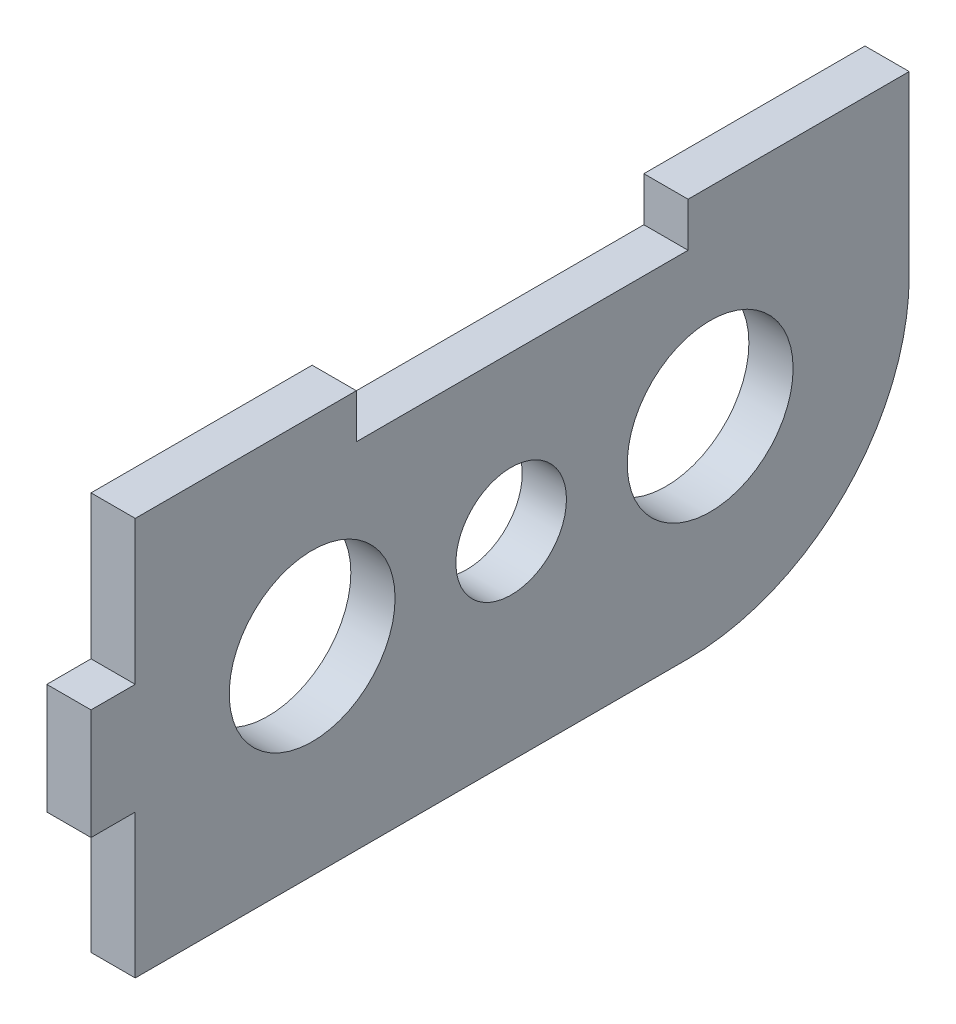
from build123d import *

# Parameters (mm, degrees)
AUFSATZ_LINEAR_AUSTRAGEN1_DEPTH = 4
SKIZZE3_W                       = 30
SKIZZE3_H                       = 4
SCHNITT_LINEAR_AUSTRAGEN2_DEPTH = 77.26270386
VERRUNDUNG1_R                   = 20
SKIZZE5_R                       = 7.5
SKIZZE5_R_2                     = 5
SCHNITT_LINEAR_AUSTRAGEN4_DEPTH = 77.26270386


with BuildPart() as part:
    # Skizze1 → Aufsatz-Linear austragen1 (new body)
    with BuildSketch(Plane(origin=(0, 0, 0), x_dir=(0, 0, -1), z_dir=(1, 0, 0))):
        Polygon((0, -5), (0, 5), (4, 5), (4, 18), (74, 18), (74, -18), (4, -18), (4, -5), align=None)
    extrude(amount=AUFSATZ_LINEAR_AUSTRAGEN1_DEPTH)

    # Skizze3 → Schnitt-Linear austragen2 (cut, through all)
    with BuildSketch(Plane(origin=(4, 0, 0), x_dir=(0, 0, -1), z_dir=(1, 0, 0))):
        with Locations((39, 16)):
            Rectangle(SKIZZE3_W, SKIZZE3_H)
    extrude(amount=-SCHNITT_LINEAR_AUSTRAGEN2_DEPTH, mode=Mode.SUBTRACT)

    # Verrundung1
    verrundung1_edges = [part.edges().sort_by_distance(p)[0] for p in [
        (2, -18, -74),
    ]]
    fillet(verrundung1_edges, radius=VERRUNDUNG1_R)

    # Skizze5 → Schnitt-Linear austragen4 (cut, through all)
    with BuildSketch(Plane(origin=(4, 0, 0), x_dir=(0, 0, -1), z_dir=(1, 0, 0))):
        with Locations((20, 0)):
            Circle(SKIZZE5_R)
        with Locations((56, 0)):
            Circle(SKIZZE5_R)
        with Locations((38, 0)):
            Circle(SKIZZE5_R_2)
    extrude(amount=-SCHNITT_LINEAR_AUSTRAGEN4_DEPTH, mode=Mode.SUBTRACT)


solid = part.part
